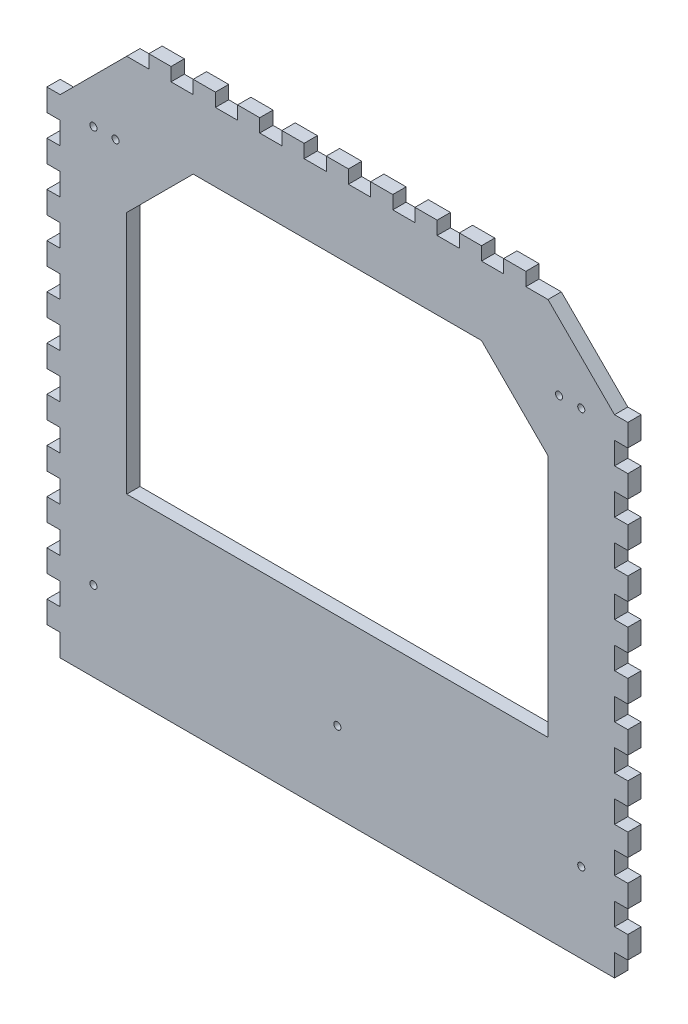
from build123d import *

# Parameters (mm, degrees)
SKIZZE1_R                       = 1.6
AUFSATZ_LINEAR_AUSTRAGEN1_DEPTH = 6


with BuildPart() as part:
    # Skizze1 → Aufsatz-Linear austragen1 (new body)
    with BuildSketch(Plane.XY):
        Polygon((35, 250), (45, 250), (45, 256), (55, 256), (55, 250), (65, 250), (65, 256), (75, 256), (75, 250), (85, 250), (85, 256), (95, 256), (95, 250), (105, 250), (105, 256), (115, 256), (115, 250), (125, 250), (125, 256), (135, 256), (135, 250), (145, 250), (145, 256), (155, 256), (155, 250), (165, 250), (165, 256), (175, 256), (175, 250), (185, 250), (185, 256), (195, 256), (195, 250), (205, 250), (205, 256), (215, 256), (215, 250), (225, 250), (255, 220), (261, 220), (261, 210), (255, 210), (255, 200), (261, 200), (261, 190), (255, 190), (255, 180), (261, 180), (261, 170), (255, 170), (255, 160), (261, 160), (261, 150), (255, 150), (255, 140), (261, 140), (261, 130), (255, 130), (255, 120), (261, 120), (261, 110), (255, 110), (255, 100), (261, 100), (261, 90), (255, 90), (255, 80), (261, 80), (261, 70), (255, 70), (255, 60), (261, 60), (261, 50), (255, 50), (255, 40), (261, 40), (261, 30), (255, 30), (255, 20), (261, 20), (261, 10), (255, 10), (255, 0), (5, 0), (5, 10), (-1, 10), (-1, 20), (5, 20), (5, 30), (-1, 30), (-1, 40), (5, 40), (5, 50), (-1, 50), (-1, 60), (5, 60), (5, 70), (-1, 70), (-1, 80), (5, 80), (5, 90), (-1, 90), (-1, 100), (5, 100), (5, 110), (-1, 110), (-1, 120), (5, 120), (5, 130), (-1, 130), (-1, 140), (5, 140), (5, 150), (-1, 150), (-1, 160), (5, 160), (5, 170), (-1, 170), (-1, 180), (5, 180), (5, 190), (-1, 190), (-1, 200), (5, 200), (5, 210), (-1, 210), (-1, 220), (5, 220), align=None)
        with Locations((20, 215)):
            Circle(SKIZZE1_R, mode=Mode.SUBTRACT)
        with Locations((30, 215)):
            Circle(SKIZZE1_R, mode=Mode.SUBTRACT)
        with Locations((240, 215)):
            Circle(SKIZZE1_R, mode=Mode.SUBTRACT)
        with Locations((230, 215)):
            Circle(SKIZZE1_R, mode=Mode.SUBTRACT)
        with Locations((20, 36)):
            Circle(SKIZZE1_R, mode=Mode.SUBTRACT)
        with Locations((130, 36)):
            Circle(SKIZZE1_R, mode=Mode.SUBTRACT)
        with Locations((240, 36)):
            Circle(SKIZZE1_R, mode=Mode.SUBTRACT)
        Polygon((65, 218.971165398), (195, 218.971165398), (225, 188.971165398), (225, 78.971165398), (35, 78.971165398), (35, 188.971165398), align=None, mode=Mode.SUBTRACT)
    extrude(amount=AUFSATZ_LINEAR_AUSTRAGEN1_DEPTH)


solid = part.part
